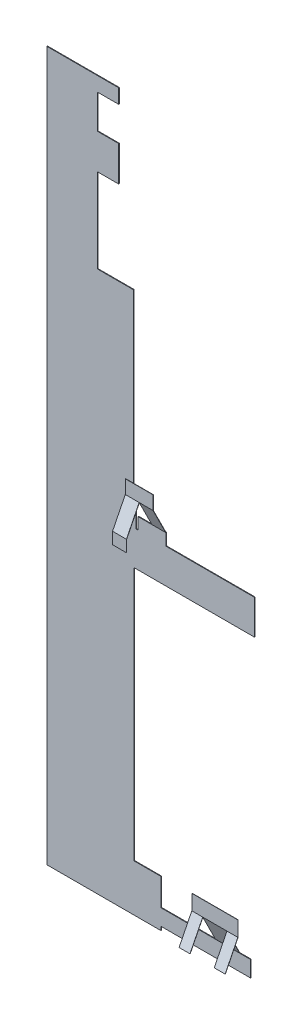
from build123d import *

# Parameters (mm, degrees)
SKETCH_1_W        = 15.2
SKETCH_1_H        = 25
SKETCH_1_W_2      = 15.9
SKETCH_1_W_3      = 60
SKETCH_1_H_2      = 55.8
SKETCH_1_H_3      = 56.6
SKETCH_1_H_4      = 59.4
SKETCH_1_W_4      = 147.9
SKETCH_1_H_5      = 26.5
SKETCH_1_H_6      = 78.6
SKETCH_1_H_7      = 80.6
SKETCH_1_H_8      = 81.1
SKETCH_1_W_5      = 59.5
SKETCH_1_H_9      = 83.5
SKETCH_1_H_10     = 84.1
SKETCH_1_H_11     = 84.6
SKETCH_1_H_12     = 84.7
SKETCH_1_H_13     = 103
SKETCH_1_H_14     = 103.2
SKETCH_1_H_15     = 105.1
SKETCH_1_H_16     = 111.3
SKETCH_1_H_17     = 127.2
SKETCH_1_H_18     = 130
EXTRUDE_1_DEPTH   = 1
SKETCH_2_W        = 45.8
SKETCH_2_H        = 19.3
EXTRUDE_2_DEPTH   = 1
EXTRUDE_3_DEPTH   = 22.9
EXTRUDE_4_DEPTH   = 22.9
SKETCH_6_W        = 0.4
SKETCH_6_H        = 25
EXTRUDE_6_DEPTH   = 40
SKETCH_7_W        = 0.4
SKETCH_7_H        = 25
EXTRUDE_7_DEPTH   = 18
EXTRUDE_720_DEPTH = 22.9


with BuildPart() as part:
    # 草图1 → 拉伸1 (new body)
    with BuildSketch(Plane.XY):
        with Locations((91, -1104.8)):
            Rectangle(SKETCH_1_W, SKETCH_1_H)
        with Locations((106.55, -1104.8)):
            Rectangle(SKETCH_1_W_2, SKETCH_1_H)
        with Locations((113.4, -865.7)):
            Rectangle(SKETCH_1_W_3, SKETCH_1_H_2)
        with Locations((30, -811.2)):
            Rectangle(SKETCH_1_W_3, SKETCH_1_H_3)
        with Locations((30, -306.2)):
            Rectangle(SKETCH_1_W_3, SKETCH_1_H_4)
        with Locations((262.05, -1150.35)):
            Rectangle(SKETCH_1_W_4, SKETCH_1_H_5)
        with Locations((30, -1130.5)):
            Rectangle(SKETCH_1_W_3, SKETCH_1_H_6)
        with Locations((30, -40.3)):
            Rectangle(SKETCH_1_W_3, SKETCH_1_H_7)
        with Locations((113.4, -713.75)):
            Rectangle(SKETCH_1_W_3, SKETCH_1_H_8)
        with Locations((113.15, -421.25)):
            Rectangle(SKETCH_1_W_5, SKETCH_1_H_9)
        with Locations((30, -1049.45)):
            Rectangle(SKETCH_1_W_3, SKETCH_1_H_9)
        with Locations((113.4, -796.05)):
            Rectangle(SKETCH_1_W_3, SKETCH_1_H_9)
        with Locations((30, -965.65)):
            Rectangle(SKETCH_1_W_3, SKETCH_1_H_10)
        with Locations((30, -881.55)):
            Rectangle(SKETCH_1_W_3, SKETCH_1_H_10)
        with Locations((30, -234.2)):
            Rectangle(SKETCH_1_W_3, SKETCH_1_H_11)
        with Locations((30, -378.25)):
            Rectangle(SKETCH_1_W_3, SKETCH_1_H_12)
        with Locations((113.4, -935.95)):
            Rectangle(SKETCH_1_W_3, SKETCH_1_H_12)
        with Locations((113.15, -328)):
            Rectangle(SKETCH_1_W_5, SKETCH_1_H_13)
        with Locations((113.15, -514.6)):
            Rectangle(SKETCH_1_W_5, SKETCH_1_H_14)
        with Locations((30, -730.35)):
            Rectangle(SKETCH_1_W_3, SKETCH_1_H_15)
        with Locations((30, -136.25)):
            Rectangle(SKETCH_1_W_3, SKETCH_1_H_16)
        Polygon((83.4, -978.3), (143.4, -978.3), (143.4, -1092.3), (114.5, -1092.3), (98.6, -1092.3), (83.4, -1092.3), align=None)
        with Locations((30, -614.2)):
            Rectangle(SKETCH_1_W_3, SKETCH_1_H_17)
        with Locations((30, -485.6)):
            Rectangle(SKETCH_1_W_3, SKETCH_1_H_18)
        Polygon((188.1, -1117.3), (188.1, -1092.3), (166.2, -1092.3), (143.4, -1092.3), (114.5, -1092.3), (114.5, -1117.3), (98.6, -1117.3), (83.4, -1117.3), (83.4, -1092.3), (83.4, -978.3), (83.4, -893.6), (83.4, -837.8), (83.4, -754.3), (83.4, -673.2), (143.4, -673.2), (342.5, -673.2), (342.5, -616.2), (192.5, -616.2), (146.7, -616.2), (146.7, -566.2), (142.9, -566.2), (83.4, -566.2), (83.4, -463), (83.4, -379.5), (83.4, -276.5), (83.4, -137.6), (118.4, -137.6), (118.4, -79.7), (83.4, -79.7), (83.4, -23.7), (118.4, -23.7), (118.4, 0), (60, 0), (60, -80.6), (60, -191.9), (60, -276.5), (60, -335.9), (60, -420.6), (60, -550.6), (60, -677.8), (60, -782.9), (60, -839.5), (60, -923.6), (60, -1007.7), (60, -1091.2), (60, -1169.8), (188.1, -1169.8), (188.1, -1163.6), (188.1, -1137.1), align=None)
    extrude(amount=-EXTRUDE_1_DEPTH)

    # 草图2 → 拉伸2 (add)
    with BuildSketch(Plane.XY):
        with Locations((173.2, -606.55)):
            Rectangle(SKETCH_2_W, SKETCH_2_H)
    extrude(amount=-EXTRUDE_2_DEPTH)

    # 草图3 → 拉伸3 (add)
    with BuildSketch(Plane(origin=(173.2, -616.2, 0), x_dir=(0, 0, -1), z_dir=(1, 0, 0))):
        Polygon((-21.04289792, 83.799959106), (-21, 61.3), (-20.5, 61.3), (-20.54289792, 83.799959106), align=None)
        Polygon((-21, 61.3), (0, 19.3), (0.5, 19.3), (-20.5, 61.3), align=None)
    extrude(amount=EXTRUDE_3_DEPTH)

    # 草图4 → 拉伸4 (add)
    with BuildSketch(Plane(origin=(173.2, -616.2, 0), x_dir=(0, 0, -1), z_dir=(1, 0, 0))):
        Polygon((-20.5, 61.3), (-20.5, 83.8), (-21.04289792, 83.799959106), (-21, 61.3), align=None)
    extrude(amount=-EXTRUDE_4_DEPTH)

    # 草图6 → 拉伸6 (add)
    with BuildSketch(Plane(origin=(318, -1163.6, 0), x_dir=(0, 0, -1), z_dir=(1, 0, 0))):
        with Locations((-20.7, 81)):
            Rectangle(SKETCH_6_W, SKETCH_6_H)
        Polygon((-20.9, 68.5), (0.1, 26.5), (0.5, 26.5), (-20.5, 68.5), align=None)
    extrude(amount=-EXTRUDE_6_DEPTH)

    # 草图7 → 拉伸7 (add)
    with BuildSketch(Plane(origin=(318, -1163.6, 0), x_dir=(0, 0, -1), z_dir=(1, 0, 0))):
        with Locations((-20.7, 81)):
            Rectangle(SKETCH_7_W, SKETCH_7_H)
        Polygon((-41.9, 26.5), (-41.5, 26.5), (-20.5, 68.5), (-20.9, 68.5), align=None)
    extrude_7 = extrude(amount=EXTRUDE_7_DEPTH)

    # 镜像1: 拉伸7 across plane
    add(extrude_7.mirror(Plane(origin=(298, -1163.6, 0), x_dir=(0, 0, 1), z_dir=(1, 0, 0))))

    # 草图9 → 凸台-拉伸720 (add)
    with BuildSketch(Plane.ZY.offset(-150.3)):
        Polygon((21, -554.9), (20.5, -554.9), (41.5, -596.9), (41.5, -616.2), (42, -616.2), (42, -596.9), align=None)
    extrude(amount=-EXTRUDE_720_DEPTH)


solid = part.part
